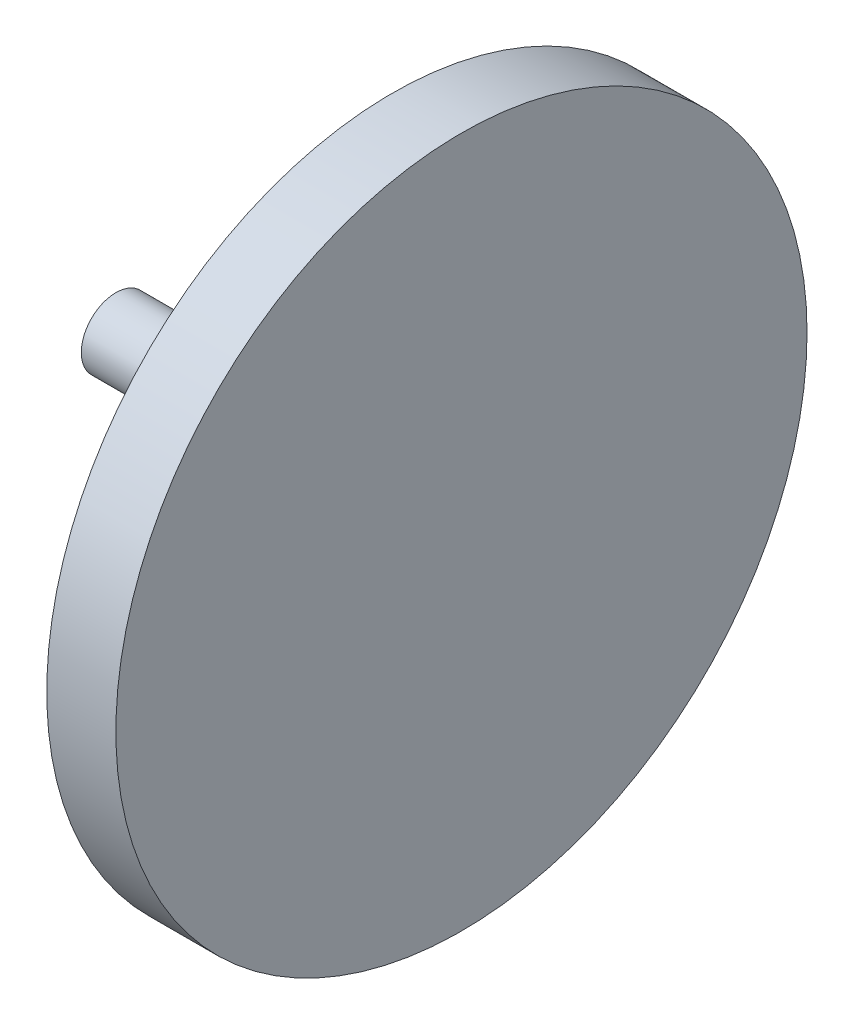
from build123d import *

# Parameters (mm, degrees)
BOSS_EXTRUDE1_DEPTH      = 15
BOSS_EXTRUDE1_DEPTH_BACK = 5
SKETCH1_R                = 2.5
SKETCH2_R                = 25
BOSS_EXTRUDE2_DEPTH      = 5


with BuildPart() as part:
    # Sketch1 → Boss-Extrude1 (new, two sides: drawn at the far end of the back side and taken through both)
    with BuildSketch(Plane(origin=(0, 0, 0), x_dir=(0, 0, -1), z_dir=(1, 0, 0)).offset(-BOSS_EXTRUDE1_DEPTH_BACK)):
        Circle(SKETCH1_R)
    extrude(amount=BOSS_EXTRUDE1_DEPTH + BOSS_EXTRUDE1_DEPTH_BACK)

    # Sketch2 → Boss-Extrude2 (add)
    with BuildSketch(Plane(origin=(15, 0, 0), x_dir=(0, 0, -1), z_dir=(1, 0, 0))):
        Circle(SKETCH2_R)
    extrude(amount=BOSS_EXTRUDE2_DEPTH)


solid = part.part
